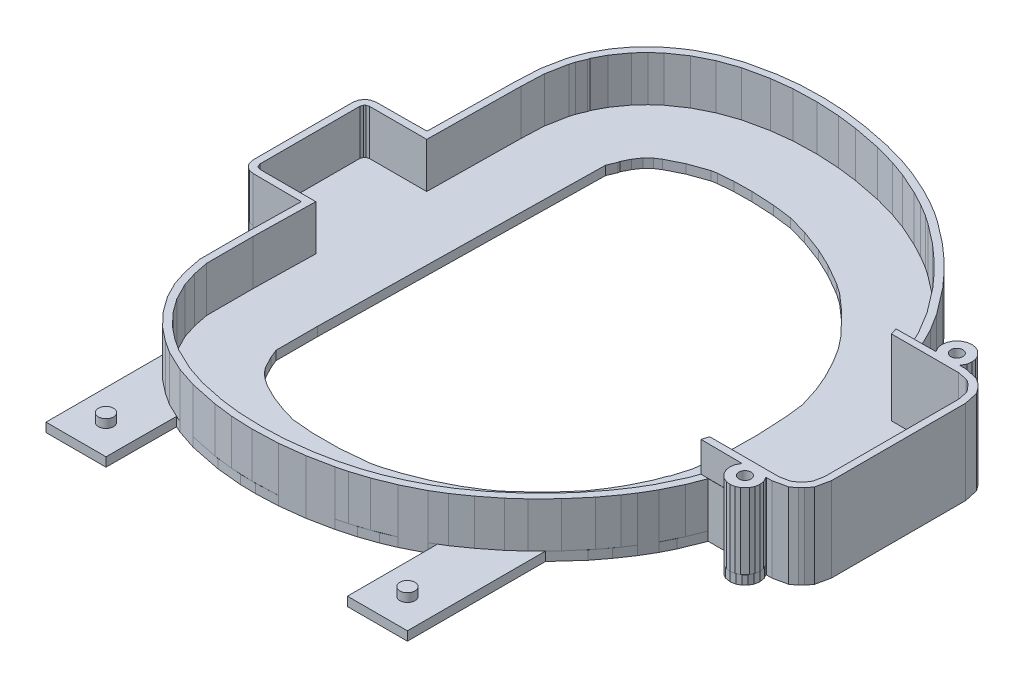
from build123d import *

# Parameters (mm, degrees)
FLOOR_RING_TONGUES_DEPTH = 3
RIM_DEPTH                = 15
PEDAL_HOOD_WALLS_DEPTH   = 25
SKETCH4_R                = 2
COVER_INSERT_HOLES_DEPTH = 7
SKETCH5_R                = 2.5
BOX_PEGS_DEPTH           = 2.8


with BuildPart() as part:
    # Sketch1 → Floor (ring + tongues) (new body)
    with BuildSketch(Plane(origin=(0, 0, 0), x_dir=(1, 0, 0), z_dir=(0, 1, 0))):
        Polygon((-54.2, 93.7), (-57.3, 91.7), (-60.6, 89.2), (-65.2, 84.7), (-68.2, 80.8), (-70, 77.9), (-71.3, 75.3), (-72.7, 71.6), (-73.2, 69.9), (-74.6, 62.9), (-74.8, 61), (-75.4, 26.1), (-92.1, 26), (-93.9, 25.6), (-94.6, 25.1), (-95.6, 23.9), (-96, 22.1), (-96, -11), (-95.6, -12.8), (-95.1, -13.5), (-93.9, -14.5), (-92.1, -14.9), (-76, -15), (-76.3, -33.1), (-76.3, -48.4), (-75.1, -54.4), (-74, -58.1), (-71.6, -63.3), (-70, -65.8), (-70, -105.7), (-50.1, -105.7), (-50, -82.4), (-48, -83.3), (-41.4, -85.5), (-31.1, -87.6), (-22.8, -88.4), (-17.7, -88.5), (-10.4, -88.2), (-2.2, -87.2), (5.8, -85.6), (11.6, -84), (17.1, -82.1), (21.4, -80.3), (28, -77), (29.8, -75.8), (30, -75.9), (30, -105.7), (49.9, -105.7), (49.9, -59.9), (56.6, -52.5), (60.1, -47.9), (63.5, -42.9), (66.1, -38.5), (68.1, -34.5), (71.1, -27.1), (82.2, -27.1), (82.3, -27.2), (81.5, -28.7), (81.3, -30.1), (81.5, -31.5), (82.1, -32.8), (83.3, -34.1), (84.6, -34.8), (86.3, -35.1), (88, -34.8), (89.3, -34.1), (90.3, -33.1), (91, -31.8), (91.3, -30.1), (91, -28.4), (90.3, -27.2), (90.4, -27.1), (92.2, -27.1), (96.8, -26.1), (98.7, -24.7), (99.7, -23.7), (101.1, -21.8), (102.1, -17.2), (102.1, 27.3), (101.1, 31.9), (99.7, 33.8), (98.7, 34.8), (96.8, 36.2), (92.2, 37.2), (90.4, 37.2), (90.3, 37.3), (91, 38.5), (91.3, 40.2), (91, 41.9), (90.3, 43.2), (89.3, 44.2), (88, 44.9), (86.3, 45.2), (84.6, 44.9), (83.3, 44.2), (82.1, 42.9), (81.5, 41.6), (81.3, 40.2), (81.5, 38.8), (82.3, 37.3), (82.2, 37.2), (71.7, 37.2), (68.9, 45.1), (66.3, 50.5), (64.5, 53.7), (61.7, 58.1), (58.4, 62.6), (55.2, 66.6), (51.5, 70.7), (47.1, 75.1), (43.7, 78.2), (39.9, 81.3), (33.5, 86), (25.7, 90.6), (17.4, 94.4), (11.8, 96.4), (7, 97.8), (-4, 100.1), (-12.8, 101.2), (-22, 101.5), (-30.2, 101), (-33.6, 100.5), (-40.9, 99), (-47.8, 96.8), align=None)
        Polygon((-30.2, 77.2), (-25.1, 77.6), (-19.1, 77.7), (-11.6, 77.3), (-5.2, 76.5), (1.2, 74.7), (8.7, 71.9), (14.8, 69), (21.4, 65.2), (24.7, 62.9), (30.6, 57.7), (37.2, 50.8), (40.3, 46.9), (43.2, 42.3), (46.3, 36.4), (48.4, 31.4), (50.5, 24.7), (51.2, 18.7), (51.7, 8.7), (51.6, -1.8), (51.1, -8.8), (50.7, -11.9), (49, -17.6), (48.5, -18.5), (47.4, -21.6), (44.5, -27.6), (41.9, -32), (39.1, -36.1), (33.7, -42.2), (27.1, -48.5), (24.3, -50.8), (21.7, -52.6), (17.1, -55.4), (10.5, -58.7), (4, -61.3), (-1.3, -63), (-4.2, -63.7), (-13.8, -64.6), (-22.8, -64.6), (-29.7, -64), (-33.7, -62.9), (-39.2, -60.8), (-43.6, -58.6), (-46.3, -56.8), (-48.1, -55.1), (-49.3, -53.6), (-51.3, -49.8), (-52.5, -46.9), (-52.5, -33.1), (-51, 61), (-49.8, 63.8), (-49.7, 64.4), (-48.4, 67), (-46.9, 69.2), (-45.1, 70.9), (-43.3, 72.1), (-38.1, 74.7), (-31.9, 76.9), align=None, mode=Mode.SUBTRACT)
    extrude(amount=FLOOR_RING_TONGUES_DEPTH)

    # Sketch2 → Rim (add)
    with BuildSketch(Plane(origin=(0, 3, 0), x_dir=(1, 0, 0), z_dir=(0, 1, 0))):
        Polygon((-26.8, 101.3), (-33.6, 100.5), (-42.5, 98.6), (-49, 96.3), (-54.2, 93.7), (-57.3, 91.7), (-60.1, 89.6), (-62.9, 87.1), (-65.7, 84.1), (-68.6, 80.2), (-71.3, 75.3), (-72.6, 71.9), (-73.2, 69.9), (-74.6, 62.9), (-75, 54.6), (-75.4, 26.1), (-92.1, 26), (-93.9, 25.6), (-95.1, 24.6), (-95.7, 23.6), (-96, 22.1), (-96, -11), (-95.6, -12.8), (-94.6, -14), (-93.6, -14.6), (-92.1, -14.9), (-76, -15), (-76.3, -33.1), (-76.3, -48.4), (-75.1, -54.4), (-73.5, -59.4), (-70.9, -64.5), (-67, -69.9), (-62.8, -74.2), (-58.5, -77.6), (-54.5, -80.2), (-48, -83.3), (-41.4, -85.5), (-32.3, -87.4), (-25.9, -88.2), (-18.9, -88.5), (-10.4, -88.2), (-2.2, -87.2), (5.8, -85.6), (9.3, -84.7), (14.9, -82.9), (21.4, -80.3), (28, -77), (32.3, -74.4), (37.3, -70.9), (42.9, -66.5), (47, -62.8), (52.5, -57.2), (57.7, -51.1), (61.3, -46.2), (63.5, -42.9), (66.1, -38.5), (69, -32.5), (71.1, -27.1), (92.2, -27.1), (96.8, -26.1), (98.7, -24.7), (99.7, -23.7), (101.1, -21.8), (102.1, -17.2), (102.1, 27.3), (101.1, 31.9), (99.7, 33.8), (98.7, 34.8), (96.8, 36.2), (92.2, 37.2), (71.7, 37.2), (68.9, 45.1), (65.2, 52.5), (61.7, 58.1), (55.2, 66.6), (51.5, 70.7), (47.1, 75.1), (42.4, 79.3), (35.5, 84.6), (32.3, 86.8), (28.6, 89), (24.3, 91.3), (17.4, 94.4), (11.8, 96.4), (5, 98.3), (-4, 100.1), (-11.6, 101.1), (-19.1, 101.5), align=None)
        Polygon((-26.8, 99), (-19.1, 99.2), (-11.6, 98.8), (-5.2, 98), (4, 96.2), (10.8, 94.3), (16.1, 92.4), (23, 89.3), (27.7, 86.8), (31.4, 84.6), (34.3, 82.6), (40.8, 77.6), (45.5, 73.4), (49.8, 69.1), (53.5, 65), (59.7, 56.9), (64.1, 49.6), (67.6, 42.1), (69.2, 37.5), (69.9, 34.9), (92.2, 34.9), (95.2, 34.3), (95.9, 34), (97.1, 33.1), (98.9, 31), (99.2, 30.3), (99.8, 27.3), (99.8, -17.2), (99.1, -20.5), (98, -22.1), (97.1, -23), (95.5, -24.1), (92.2, -24.8), (69.3, -24.8), (67.6, -29.8), (63.9, -37.6), (61.3, -42), (58.1, -46.7), (53.4, -52.7), (49.4, -57.1), (44.1, -62.3), (38.1, -67.4), (31.7, -72), (27.1, -74.8), (21.4, -77.7), (15.8, -80.1), (10.6, -81.9), (4.8, -83.5), (-2.2, -84.9), (-10.4, -85.9), (-17.7, -86.2), (-25.9, -85.9), (-32.3, -85.1), (-40.4, -83.4), (-46.7, -81.3), (-53.6, -78), (-57.3, -75.6), (-61.2, -72.5), (-65.3, -68.3), (-68.7, -63.6), (-71.5, -58.1), (-73, -53.4), (-74, -48.4), (-74, -33.1), (-73.6, -12.6), (-92.1, -12.6), (-93, -12.3), (-93.4, -11.9), (-93.7, -11), (-93.7, 22.1), (-93.4, 23), (-93, 23.4), (-92.1, 23.7), (-73.1, 23.7), (-72.7, 54.6), (-72.4, 62), (-71.1, 68.9), (-70.6, 70.6), (-69.4, 73.4), (-69.3, 74), (-67.2, 78), (-64, 82.5), (-61.3, 85.4), (-58.5, 87.9), (-53.3, 91.5), (-47.7, 94.3), (-41.5, 96.5), (-33.6, 98.2), align=None, mode=Mode.SUBTRACT)
    extrude(amount=RIM_DEPTH)

    # Sketch3 → Pedal hood walls (add)
    with BuildSketch(Plane(origin=(0, 3, 0), x_dir=(1, 0, 0), z_dir=(0, 1, 0))):
        Polygon((86.3, 45.2), (84.9, 45), (83.6, 44.4), (82.1, 42.9), (81.5, 41.6), (81.3, 40.2), (81.5, 38.8), (82.3, 37.3), (82.2, 37.2), (69.2, 37.1), (69.9, 34.9), (92.2, 34.9), (95.2, 34.3), (95.9, 34), (97.1, 33.1), (98.9, 31), (99.2, 30.3), (99.8, 27.3), (99.8, -17.2), (99.2, -20.2), (98.9, -20.9), (98, -22.1), (97.1, -23), (95.9, -23.9), (95.2, -24.2), (92.2, -24.8), (69.3, -24.8), (68.6, -27), (82.2, -27.1), (82.3, -27.2), (81.5, -28.7), (81.3, -30.1), (81.5, -31.5), (82.1, -32.8), (83.6, -34.3), (84.9, -34.9), (86.3, -35.1), (87.7, -34.9), (89, -34.3), (90.5, -32.8), (91.1, -31.5), (91.3, -30.1), (91.1, -28.7), (90.3, -27.2), (90.4, -27.1), (92.2, -27.1), (96.8, -26.1), (98.7, -24.7), (99.7, -23.7), (101.1, -21.8), (102.1, -17.2), (102.1, 27.3), (101.1, 31.9), (99.7, 33.8), (98.7, 34.8), (96.8, 36.2), (92.2, 37.2), (90.4, 37.2), (90.3, 37.3), (91.1, 38.8), (91.3, 40.2), (91.1, 41.6), (90.5, 42.9), (89, 44.4), (87.7, 45), align=None)
    extrude(amount=PEDAL_HOOD_WALLS_DEPTH)

    # Sketch4 → Cover insert holes (cut)
    with BuildSketch(Plane(origin=(0, 28, 0), x_dir=(1, 0, 0), z_dir=(0, 1, 0))):
        with Locations(Location((86.28, 40.2, 0), (0, 0, 270))):
            Circle(SKETCH4_R)
        with Locations(Location((86.28, -30.1, 0), (0, 0, 270))):
            Circle(SKETCH4_R)
    extrude(amount=-COVER_INSERT_HOLES_DEPTH, mode=Mode.SUBTRACT)

    # Sketch5 → Box pegs (add)
    with BuildSketch(Plane(origin=(0, 3, 0), x_dir=(1, 0, 0), z_dir=(0, 1, 0))):
        with Locations(Location((-60, -95.8, 0), (0, 0, 90))):
            Circle(SKETCH5_R)
        with Locations(Location((40, -95.8, 0), (0, 0, 90))):
            Circle(SKETCH5_R)
    extrude(amount=BOX_PEGS_DEPTH)


solid = part.part
